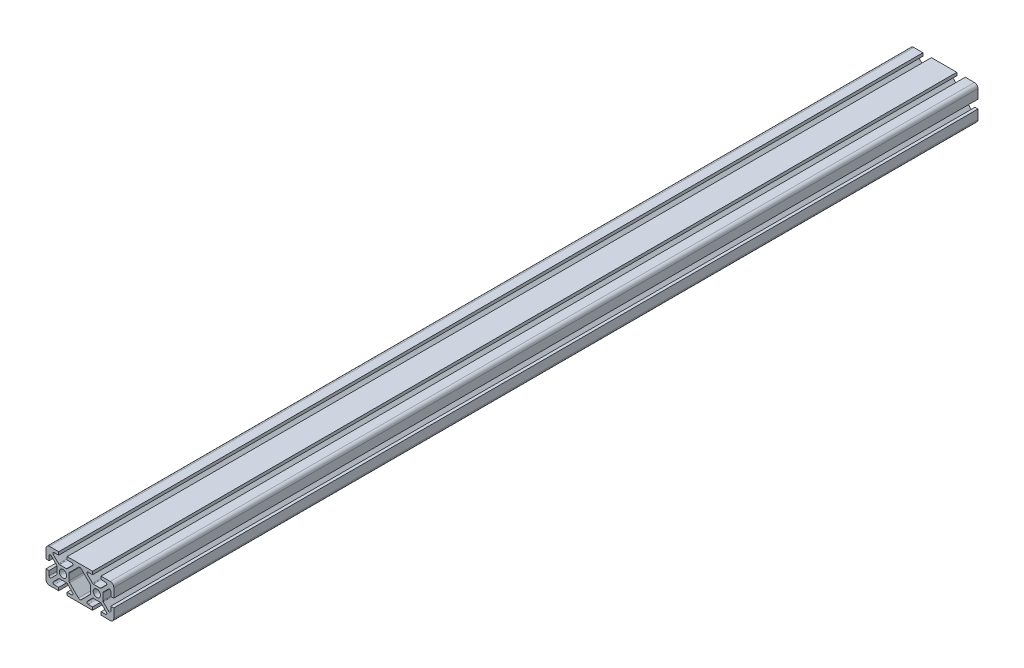
from build123d import *

# Parameters (mm, degrees)
BOSS_EXTRUDE1_DEPTH = 1524
BOSS_EXTRUDE2_DEPTH = 1524
FILLET1_R           = 0.75
FILLET2_R           = 1.25
SKETCH5_W           = 2538
SKETCH5_H           = 20
CUT_EXTRUDE1_DEPTH  = 1525.55764076


with BuildPart() as part:
    # Sketch3 → Boss-Extrude1 (new, symmetric)
    with BuildSketch(Plane.XY):
        with BuildLine():
            Line((12.5, -10), (17.9, -10))
            ThreePointArc((17.9, -10), (19.38492424, -9.38492424), (20, -7.9))
            Line((20, -7.9), (20, -2.5))
            Line((20, -2.5), (18.213351365, -2.5))
            Line((18.213351365, -2.5), (18.213351365, -6.95))
            Line((18.213351365, -6.95), (13.6, -2.336648635))
            Line((13.6, -2.336648635), (13.6, 0))
            Line((13.6, 0), (12.15, 0))
            ThreePointArc((12.15, 0), (11.52027958, -1.52027958), (10, -2.15))
            Line((10, -2.15), (10, -3.6))
            Line((10, -3.6), (12.336648635, -3.6))
            Line((12.336648635, -3.6), (16.95, -8.213351365))
            Line((16.95, -8.213351365), (12.5, -8.213351365))
            Line((12.5, -8.213351365), (12.5, -10))
        make_face()
    extrude(amount=BOSS_EXTRUDE1_DEPTH, both=True)

    # Sketch4 → Boss-Extrude2 (add, symmetric)
    with BuildSketch(Plane.XY):
        with BuildLine():
            Line((10, -3.6), (7.663351365, -3.6))
            Line((7.663351365, -3.6), (3.05, -8.213351365))
            Line((3.05, -8.213351365), (7.5, -8.213351365))
            Line((7.5, -8.213351365), (7.5, -10))
            Line((7.5, -10), (0, -10))
            Line((0, -10), (0, -8.736648635))
            Line((0, -8.736648635), (6.4, -2.336648635))
            Line((6.4, -2.336648635), (6.4, 0))
            Line((6.4, 0), (7.85, 0))
            ThreePointArc((7.85, 0), (8.47972042, -1.52027958), (10, -2.15))
            Line((10, -2.15), (10, -3.6))
        make_face()
    extrude(amount=BOSS_EXTRUDE2_DEPTH, both=True)

    # Mirror1: part across plane


with BuildPart() as part_1:
    add(part.part)
    add(part.part.mirror(Plane(origin=(0, 0, 0), x_dir=(0, 0, 1), z_dir=(1, 0, 0))))

    # Mirror2: part across plane


with BuildPart() as part_2:
    add(part_1.part)
    add(part_1.part.mirror(Plane.ZX))

    # Fillet1
    fillet1_edges = [part_2.edges().sort_by_distance(p)[0] for p in [
        (18.213351365, 6.95, 0),
        (13.6, 2.336648635, 0),
        (12.336648635, 3.6, 0),
        (16.95, 8.213351365, 0),
        (3.05, 8.213351365, 0),
        (7.663351365, 3.6, 0),
        (-18.213351365, 6.95, 0),
        (-13.6, 2.336648635, 0),
        (-7.663351365, 3.6, 0),
        (-12.336648635, 3.6, 0),
        (-16.95, 8.213351365, 0),
        (-3.05, 8.213351365, 0),
        (16.95, -8.213351365, 0),
        (12.336648635, -3.6, 0),
        (13.6, -2.336648635, 0),
        (18.213351365, -6.95, 0),
        (3.05, -8.213351365, 0),
        (7.663351365, -3.6, 0),
        (-18.213351365, -6.95, 0),
        (-13.6, -2.336648635, 0),
        (-12.336648635, -3.6, 0),
        (-16.95, -8.213351365, 0),
        (-3.05, -8.213351365, 0),
        (-7.663351365, -3.6, 0),
    ]]
    fillet(fillet1_edges, radius=FILLET1_R)

    # Fillet2
    fillet2_edges = [part_2.edges().sort_by_distance(p)[0] for p in [
        (6.4, 2.336648635, 0),
        (0, 8.736648635, 0),
        (-6.4, 2.336648635, 0),
        (6.4, -2.336648635, 0),
        (-6.4, -2.336648635, 0),
        (0, -8.736648635, 0),
    ]]
    fillet(fillet2_edges, radius=FILLET2_R)

    # Sketch5 → Cut-Extrude1 (cut, through all)
    with BuildSketch(Plane.ZY.offset(20)):
        with Locations((255, 0)):
            Rectangle(SKETCH5_W, SKETCH5_H)
    extrude(amount=-CUT_EXTRUDE1_DEPTH, mode=Mode.SUBTRACT)


solid = part_2.part
